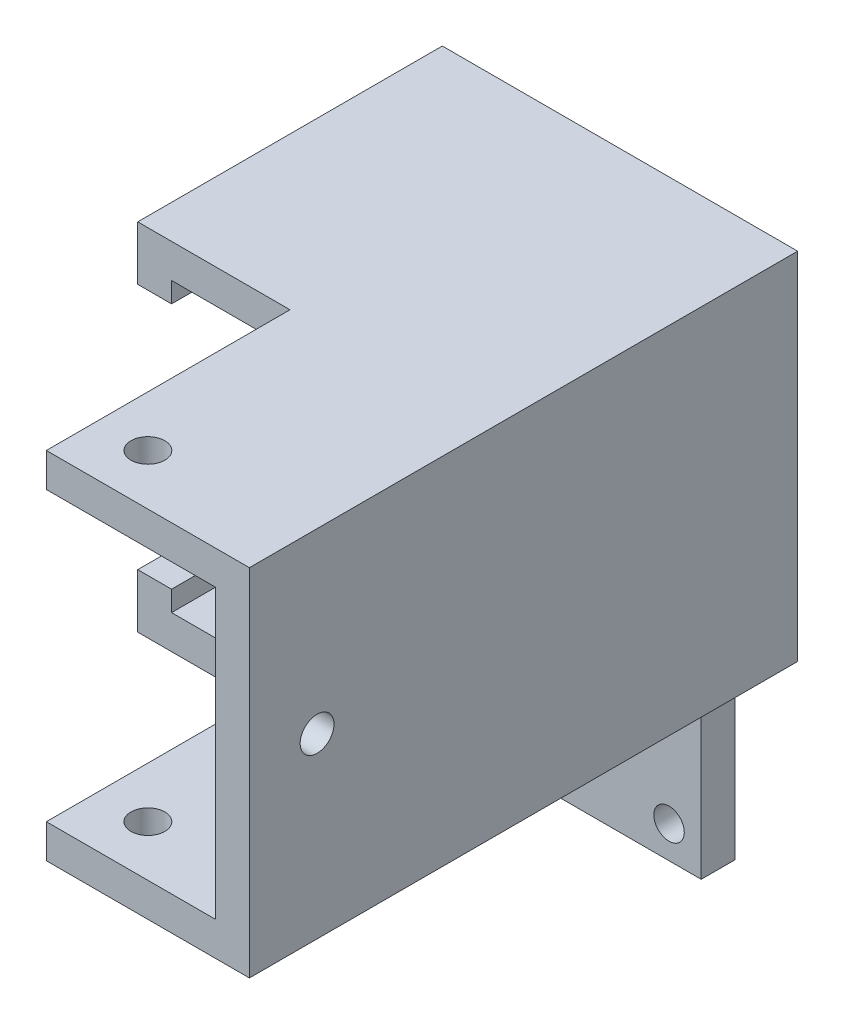
from build123d import *

# Parameters (mm, degrees)
SKETCH1_R               = 2.25
BOSS_EXTRUDE1_DEPTH     = 5
SKETCH2_W               = 52.5
SKETCH2_H               = 52.5
SKETCH2_W_2             = 42.5
SKETCH2_H_2             = 42.5
BOSS_EXTRUDE2_DEPTH     = 40
BOSS_EXTRUDE3_DEPTH     = 36
CUT_EXTRUDE2_DEPTH      = 121.157448791
CUT_EXTRUDE2_DEPTH_BACK = 121.157448791
SKETCH6_R               = 2.5
CUT_EXTRUDE3_DEPTH      = 127.97834461
CUT_EXTRUDE3_DEPTH_BACK = 127.97834461
SKETCH7_R               = 2.5
SKETCH8_W               = 40
SKETCH8_H               = 36.5
CUT_EXTRUDE4_DEPTH      = 24


with BuildPart() as part:
    # Sketch1 → Boss-Extrude1 (new body)
    with BuildSketch(Plane.XY):
        Polygon((0, 30), (-9.25, 30), (-9.25, 82.5), (43.25, 82.5), (43.25, 30), (34, 30), (34, 0), (0, 0), align=None)
        with Locations((4.75, 25.25)):
            Circle(SKETCH1_R, mode=Mode.SUBTRACT)
        with Locations((29.25, 25.25)):
            Circle(SKETCH1_R, mode=Mode.SUBTRACT)
        with Locations((29.25, 4.75)):
            Circle(SKETCH1_R, mode=Mode.SUBTRACT)
        with Locations((4.75, 4.75)):
            Circle(SKETCH1_R, mode=Mode.SUBTRACT)
    extrude(amount=BOSS_EXTRUDE1_DEPTH)

    # Sketch2 → Boss-Extrude2 (add)
    with BuildSketch(Plane.XY.offset(5)):
        with Locations((17, 56.25)):
            Rectangle(SKETCH2_W, SKETCH2_H)
        with Locations((17, 56.25)):
            Rectangle(SKETCH2_W_2, SKETCH2_H_2, mode=Mode.SUBTRACT)
    extrude(amount=BOSS_EXTRUDE2_DEPTH)

    # Sketch5 → Boss-Extrude3 (add)
    with BuildSketch(Plane.XY.offset(45)):
        Polygon((43.25, 82.5), (43.25, 30), (13.25, 30), (13.25, 35), (38.25, 35), (38.25, 77.5), (13.25, 77.5), (13.25, 82.5), align=None)
    extrude(amount=BOSS_EXTRUDE3_DEPTH)

    # Sketch6 → Cut-Extrude2 (cut, two sides: drawn at the far end of the back side and taken through both)
    with BuildSketch(Plane.XZ.offset(-77.5).offset(-CUT_EXTRUDE2_DEPTH_BACK)):
        with Locations(Location((20.75, 73.5, 0), (0, 0, 270))):
            Circle(SKETCH6_R)
    extrude(amount=CUT_EXTRUDE2_DEPTH + CUT_EXTRUDE2_DEPTH_BACK, mode=Mode.SUBTRACT)

    # Sketch7 → Cut-Extrude3 (cut, two sides: drawn at the far end of the back side and taken through both)
    with BuildSketch(Plane(origin=(43.25, 0, 0), x_dir=(0, 0, -1), z_dir=(1, 0, 0)).offset(-CUT_EXTRUDE3_DEPTH_BACK)):
        with Locations(Location((-71, 56.25, 0), (0, 0, 90))):
            Circle(SKETCH7_R)
    extrude(amount=CUT_EXTRUDE3_DEPTH + CUT_EXTRUDE3_DEPTH_BACK, mode=Mode.SUBTRACT)

    # Sketch8 → Cut-Extrude4 (cut)
    with BuildSketch(Plane.ZY.offset(9.25)):
        with Locations((25, 56.25)):
            Rectangle(SKETCH8_W, SKETCH8_H)
    extrude(amount=-CUT_EXTRUDE4_DEPTH, mode=Mode.SUBTRACT)


solid = part.part
